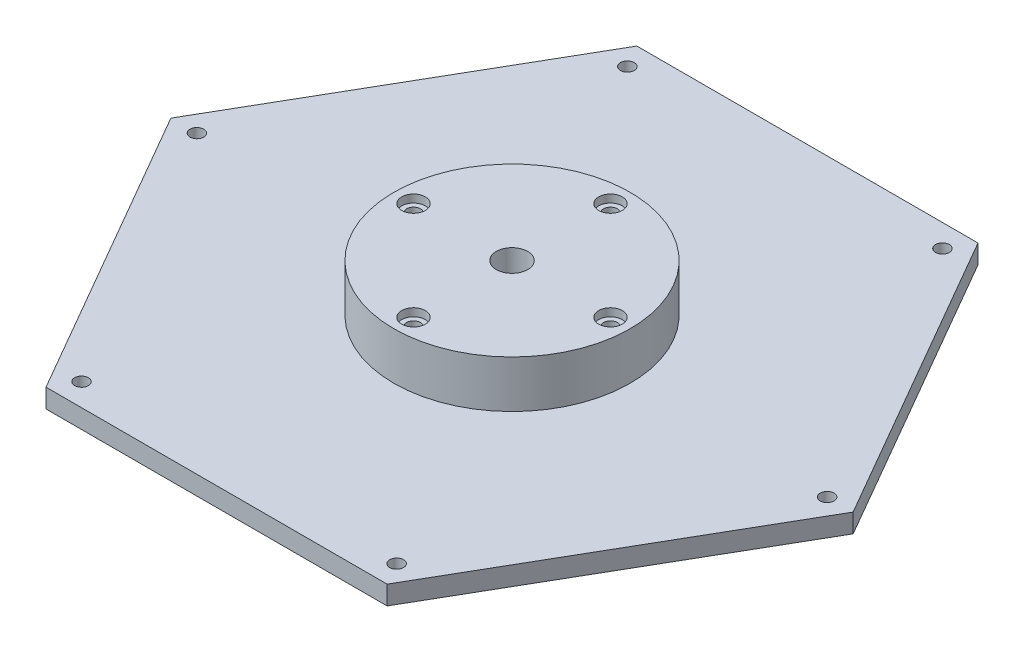
from build123d import *

# Parameters (mm, degrees)
SKETCH1_R           = 4
BOSS_EXTRUDE2_DEPTH = 4.8
SKETCH2_R           = 30
SKETCH2_R_2         = 4
BOSS_EXTRUDE3_DEPTH = 12
SKETCH3_R           = 1.75
CUT_EXTRUDE1_DEPTH  = 16.8
SKETCH4_R           = 3
CUT_EXTRUDE2_DEPTH  = 2


with BuildPart() as part:
    # Sketch1 → Boss-Extrude2 (new body)
    with BuildSketch(Plane(origin=(0, 0, 0), x_dir=(1, 0, 0), z_dir=(0, 1, 0))):
        Polygon((86.602540378, 0), (43.301270189, 75), (-43.301270189, 75), (-86.602540378, 0), (-43.301270189, -75), (43.301270189, -75), align=None)
        with Locations(Location((0, 0, 0), (0, 0, 270))):
            Circle(SKETCH1_R, mode=Mode.SUBTRACT)
    extrude(amount=BOSS_EXTRUDE2_DEPTH)

    # Sketch2 → Boss-Extrude3 (add)
    with BuildSketch(Plane(origin=(0, 4.8, 0), x_dir=(1, 0, 0), z_dir=(0, 1, 0))):
        with Locations(Location((0, 0, 0), (0, 0, 270))):
            Circle(SKETCH2_R)
        with Locations(Location((0, 0, 0), (0, 0, 270))):
            Circle(SKETCH2_R_2, mode=Mode.SUBTRACT)
    extrude(amount=BOSS_EXTRUDE3_DEPTH)

    # Sketch3 → Cut-Extrude1 (cut)
    with BuildSketch(Plane(origin=(0, 16.8, 0), x_dir=(1, 0, 0), z_dir=(0, 1, 0))):
        with Locations(Location((25, 0, 0), (0, 0, 270))):
            Circle(SKETCH3_R)
        with Locations(Location((0, -25, 0), (0, 0, 270))):
            Circle(SKETCH3_R)
        with Locations(Location((-25, 0, 0), (0, 0, 270))):
            Circle(SKETCH3_R)
        with Locations(Location((0, 25, 0), (0, 0, 270))):
            Circle(SKETCH3_R)
        with Locations(Location((40, 69.282032303, 0), (0, 0, 270))):
            Circle(SKETCH3_R)
        with Locations(Location((80, 0, 0), (0, 0, 270))):
            Circle(SKETCH3_R)
        with Locations(Location((40, -69.282032303, 0), (0, 0, 270))):
            Circle(SKETCH3_R)
        with Locations(Location((-40, -69.282032303, 0), (0, 0, 270))):
            Circle(SKETCH3_R)
        with Locations(Location((-80, 0, 0), (0, 0, 270))):
            Circle(SKETCH3_R)
        with Locations(Location((-40, 69.282032303, 0), (0, 0, 270))):
            Circle(SKETCH3_R)
    extrude(amount=-CUT_EXTRUDE1_DEPTH, mode=Mode.SUBTRACT)

    # Sketch4 → Cut-Extrude2 (cut)
    with BuildSketch(Plane(origin=(0, 16.8, 0), x_dir=(1, 0, 0), z_dir=(0, 1, 0))):
        with Locations(Location((0, 25, 0), (0, 0, 270))):
            Circle(SKETCH4_R)
        with Locations(Location((25, 0, 0), (0, 0, 270))):
            Circle(SKETCH4_R)
        with Locations(Location((0, -25, 0), (0, 0, 270))):
            Circle(SKETCH4_R)
        with Locations(Location((-25, 0, 0), (0, 0, 270))):
            Circle(SKETCH4_R)
    extrude(amount=-CUT_EXTRUDE2_DEPTH, mode=Mode.SUBTRACT)


solid = part.part
